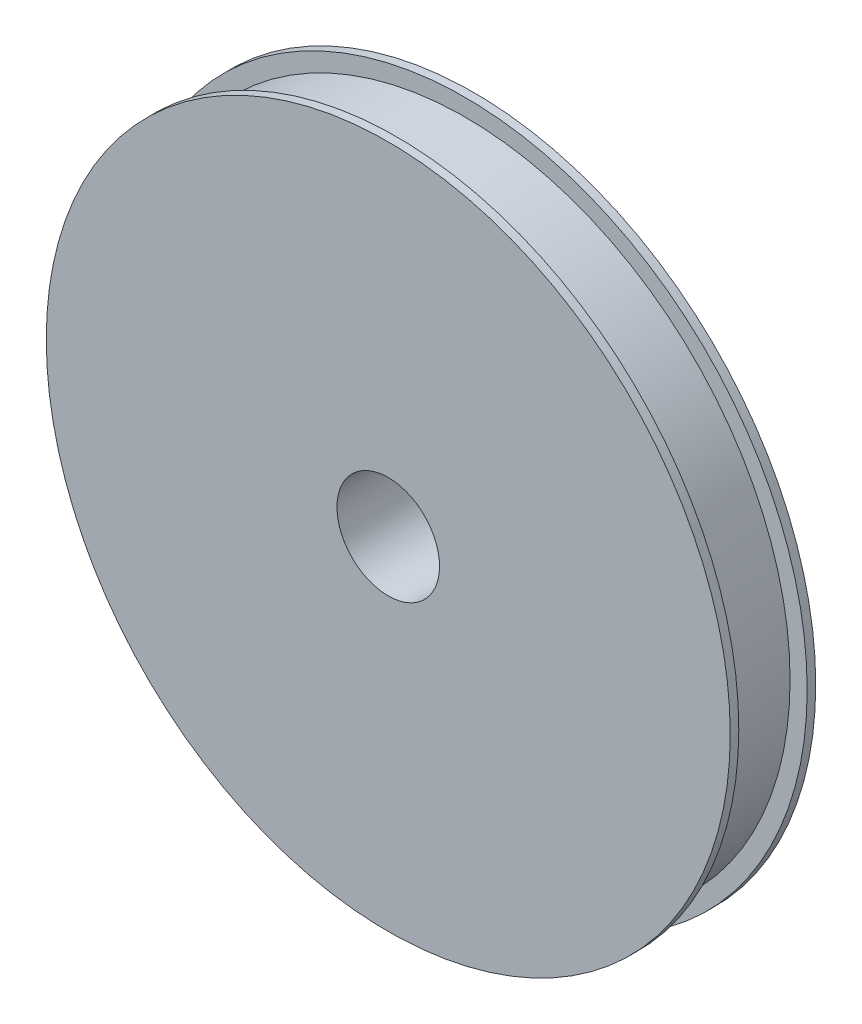
from build123d import *

# Parameters (mm, degrees)
SKETCH1_R           = 40
SKETCH1_R_2         = 6
BOSS_EXTRUDE1_DEPTH = 10
CUT_EXTRUDE1_START  = 1
SKETCH1_3_R         = 40
SKETCH1_3_R_2       = 38
CUT_EXTRUDE1_DEPTH  = 8


with BuildPart() as part:
    # Sketch1 → Boss-Extrude1 (new body)
    with BuildSketch(Plane.XY):
        Circle(SKETCH1_R)
        Circle(SKETCH1_R_2, mode=Mode.SUBTRACT)
    extrude(amount=BOSS_EXTRUDE1_DEPTH)

    # Sketch1<3> → Cut-Extrude1 (cut)
    with BuildSketch(Plane.XY.offset(CUT_EXTRUDE1_START)):
        Circle(SKETCH1_3_R)
        Circle(SKETCH1_3_R_2, mode=Mode.SUBTRACT)
    extrude(amount=CUT_EXTRUDE1_DEPTH, mode=Mode.SUBTRACT)


solid = part.part
